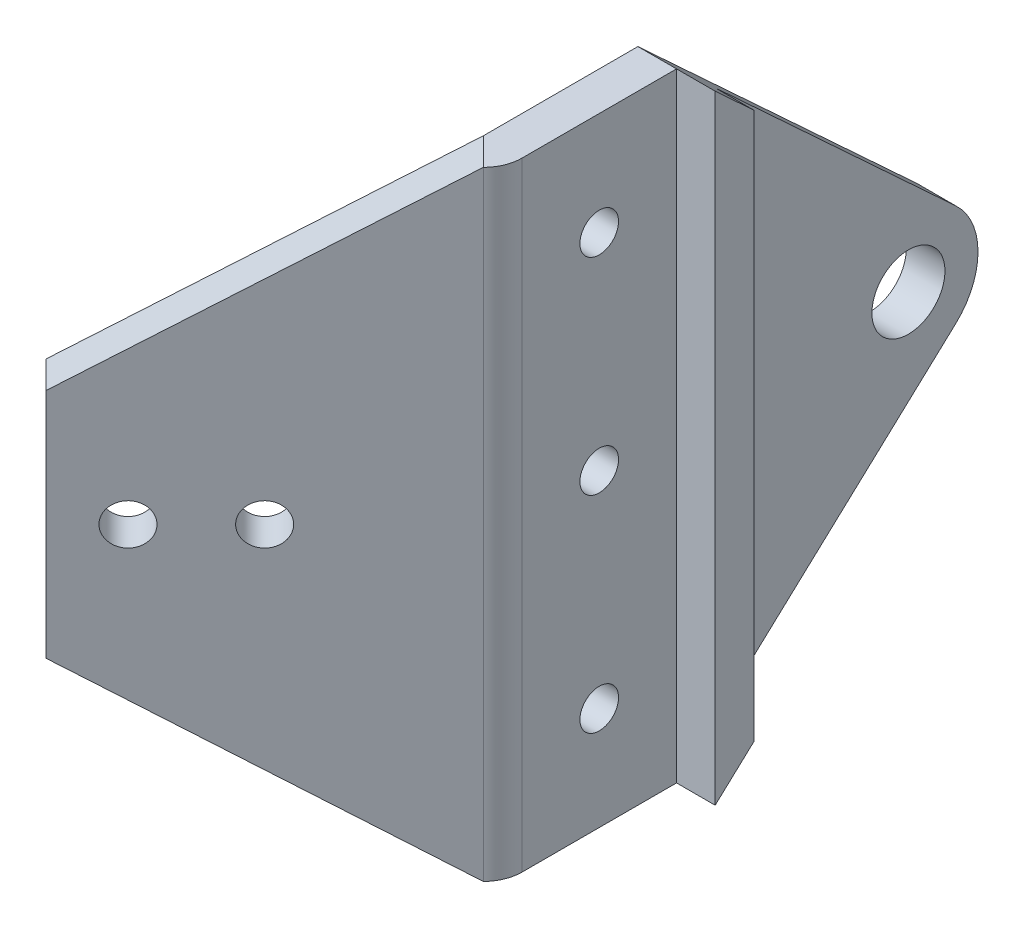
from build123d import *

# Parameters (mm, degrees)
SKETCH1_W           = 25.4
SKETCH1_H           = 101.6
SKETCH1_R           = 3.175
BOSS_EXTRUDE1_DEPTH = 6.35
BOSS_EXTRUDE2_DEPTH = 12.7
BOSS_EXTRUDE3_DEPTH = 101.6
CUT_EXTRUDE1_DEPTH  = 1015.748334056
CUT_EXTRUDE4_DEPTH  = 1015.748334056


with BuildPart() as part:
    # Sketch1 → Boss-Extrude1 (new body)
    # profile 1 of 7: a face of its own
    with BuildSketch(Plane(origin=(0, 0, 0), x_dir=(0, 0, -1), z_dir=(1, 0, 0))):
        with BuildLine():
            Line((1398.423242973, 108.323129495), (1362.627423264, 141.42442982))
            Line((1362.627423264, 141.42442982), (1362.627423264, 51.568441203))
            Line((1362.627423264, 51.568441203), (1395.68444407, 82.137104875))
            Line((1395.68444407, 82.137104875), (1389.154234775, 85.14044675))
            add(Edge.make_bspline(
                [(1398.423242973, 108.323129495), (1387.739315105, 111.977739505), (1383.021002085, 101.719425118), (1377.797813595, 90.363436356), (1389.154234775, 85.14044675)],
                knots=[1.250204036, 1.250204036, 1.250204036, 2.710509531, 2.710509531, 4.281305858, 4.281305858, 4.281305858], degree=2, weights=[0.96169376, 0.72770908, 1, 0.707106781, 1]))
        make_face()
    # profile 2 of 7: a face of its own
    with BuildSketch(Plane(origin=(0, 0, 0), x_dir=(0, 0, -1), z_dir=(1, 0, 0))):
        with BuildLine():
            Line((1402.137630748, 104.888341124), (1398.423242973, 108.323129495))
            add(Edge.make_bspline(
                [(1398.423242973, 108.323129495), (1387.739315105, 111.977739505), (1383.021002085, 101.719425118), (1377.797813595, 90.363436356), (1389.154234775, 85.14044675)],
                knots=[1.250204036, 1.250204036, 1.250204036, 2.710509531, 2.710509531, 4.281305858, 4.281305858, 4.281305858], degree=2, weights=[0.96169376, 0.72770908, 1, 0.707106781, 1]))
            Line((1389.154234775, 85.14044675), (1395.68444407, 82.137104875))
            Line((1395.68444407, 82.137104875), (1402.028477486, 88.003593115))
            Line((1402.028477486, 88.003593115), (1402.029499743, 88.005815653))
            ThreePointArc((1402.029499743, 88.005815653), (1382.947657703, 96.569642096), (1402.137630748, 104.888341124))
        make_face()
    # profile 3 of 7: a face of its own
    with BuildSketch(Plane(origin=(0, 0, 0), x_dir=(0, 0, -1), z_dir=(1, 0, 0))):
        with BuildLine():
            ThreePointArc((1405.807423264, 96.496435511), (1404.849864993, 101.076049494), (1402.137630748, 104.888341124))
            ThreePointArc((1402.137630748, 104.888341124), (1382.947657703, 96.569642096), (1402.029499743, 88.005815653))
            Line((1402.029499743, 88.005815653), (1405.803880671, 96.211881257))
            ThreePointArc((1405.803880671, 96.211881257), (1405.806537582, 96.354147359), (1405.807423264, 96.496435511))
        make_face()
        with BuildLine():
            add(Edge.make_bspline(
                [(1388.377423264, 96.496435511), (1388.377423264, 86.104526373), (1397.377423264, 91.300480942), (1406.377423264, 96.496435511), (1397.377423264, 101.69239008), (1388.377423264, 106.888344649), (1388.377423264, 96.496435511)],
                knots=[0, 0, 0, 2.094395102, 2.094395102, 4.188790205, 4.188790205, 6.283185307, 6.283185307, 6.283185307], degree=2, weights=[1, 0.5, 1, 0.5, 1, 0.5, 1]))
        make_face(mode=Mode.SUBTRACT)
    # profile 4 of 7: a face of its own
    with BuildSketch(Plane(origin=(0, 0, 0), x_dir=(0, 0, -1), z_dir=(1, 0, 0))):
        with BuildLine():
            Line((1405.803880671, 96.211881257), (1402.029499743, 88.005815653))
            ThreePointArc((1402.029499743, 88.005815653), (1402.083723308, 88.054999635), (1402.137630748, 88.104529898))
            ThreePointArc((1402.137630748, 88.104529898), (1404.792043465, 91.786808554), (1405.803880671, 96.211881257))
        make_face()
    # profile 5 of 7: a face of its own
    with BuildSketch(Plane(origin=(0, 0, 0), x_dir=(0, 0, -1), z_dir=(1, 0, 0))):
        with BuildLine():
            ThreePointArc((1402.137630748, 88.104529898), (1402.083723308, 88.054999635), (1402.029499743, 88.005815653))
            Line((1402.029499743, 88.005815653), (1402.028477486, 88.003593115))
            Line((1402.028477486, 88.003593115), (1402.137630748, 88.104529898))
        make_face()
    # profile 6 of 7: a face of its own
    with BuildSketch(Plane(origin=(0, 0, 0), x_dir=(0, 0, -1), z_dir=(1, 0, 0))):
        Polygon((1362.627423264, 51.568441203), (1362.627423264, 141.42442982), (1356.277423264, 147.296435511), (1356.277423264, 45.696435511), align=None)
    # profile 7 of 7: a face of its own
    with BuildSketch(Plane(origin=(0, 0, 0), x_dir=(0, 0, -1), z_dir=(1, 0, 0))):
        with Locations((1343.577423264, 96.496435511)):
            Rectangle(SKETCH1_W, SKETCH1_H)
        with Locations((1343.577423264, 96.496435511)):
            Circle(SKETCH1_R, mode=Mode.SUBTRACT)
        with Locations((1343.577423264, 130.363102178)):
            Circle(SKETCH1_R, mode=Mode.SUBTRACT)
        with Locations((1343.577423264, 62.629768844)):
            Circle(SKETCH1_R, mode=Mode.SUBTRACT)
    extrude(amount=BOSS_EXTRUDE1_DEPTH)

    # Sketch1<4> → Boss-Extrude2 (add)
    with BuildSketch(Plane(origin=(0, 0, 0), x_dir=(0, 0, -1), z_dir=(1, 0, 0))):
        Polygon((1362.627423264, 51.568441203), (1362.627423264, 141.42442982), (1356.277423264, 147.296435511), (1356.277423264, 45.696435511), align=None)
    extrude(amount=BOSS_EXTRUDE2_DEPTH)

    # Sketch2 → Boss-Extrude3 (add)
    with BuildSketch(Plane.XZ.offset(-45.696435511)):
        with BuildLine():
            Line((-35.921024484, -1294.95639878), (0, -1330.877423264))
            Line((0, -1330.877423264), (6.35, -1330.877423264))
            ThreePointArc((6.35, -1330.877423264), (5.866635031, -1328.447383469), (4.490128061, -1326.387295204))
            Line((4.490128061, -1326.387295204), (-31.430896424, -1290.46627072))
            Line((-31.430896424, -1290.46627072), (-35.921024484, -1294.95639878))
        make_face()
    extrude(amount=-BOSS_EXTRUDE3_DEPTH)

    # Sketch3 → Cut-Extrude1 (cut, through all)
    with BuildSketch(Plane(origin=(-665.438711632, 0, -665.438711632), x_dir=(-0.7071067811865446, 0, 0.7071067811865505), z_dir=(-0.7071067811865505, 0, -0.7071067811865446))):
        Polygon((-890.272450918, 147.296435511), (-941.072450918, 147.296435511), (-890.272450918, 115.546435511), align=None)
        Polygon((-890.272450918, 45.696435511), (-890.272450918, 77.446435511), (-941.072450918, 45.696435511), align=None)
    extrude(amount=-CUT_EXTRUDE1_DEPTH, mode=Mode.SUBTRACT)

    # Sketch7 → Cut-Extrude4 (cut, through all)
    with BuildSketch(Plane(origin=(-665.438711632, 0, -665.438711632), x_dir=(-0.7071067811865439, 0, 0.7071067811865511), z_dir=(-0.7071067811865511, 0, -0.7071067811865439))):
        with BuildLine():
            ThreePointArc((-912.299013418, 96.496435511), (-915.672450918, 99.869873011), (-919.045888418, 96.496435511))
            Line((-919.045888418, 96.496435511), (-912.299013418, 96.496435511))
        make_face()
        with BuildLine():
            Line((-912.299013418, 96.496435511), (-919.045888418, 96.496435511))
            ThreePointArc((-919.045888418, 96.496435511), (-915.672450918, 93.122998011), (-912.299013418, 96.496435511))
        make_face()
        with BuildLine():
            ThreePointArc((-903.170888418, 96.496435511), (-899.797450918, 93.122998011), (-896.424013418, 96.496435511))
            Line((-896.424013418, 96.496435511), (-903.170888418, 96.496435511))
        make_face()
        with BuildLine():
            Line((-903.170888418, 96.496435511), (-896.424013418, 96.496435511))
            ThreePointArc((-896.424013418, 96.496435511), (-899.797450918, 99.869873011), (-903.170888418, 96.496435511))
        make_face()
    extrude(amount=-CUT_EXTRUDE4_DEPTH, mode=Mode.SUBTRACT)


solid = part.part
